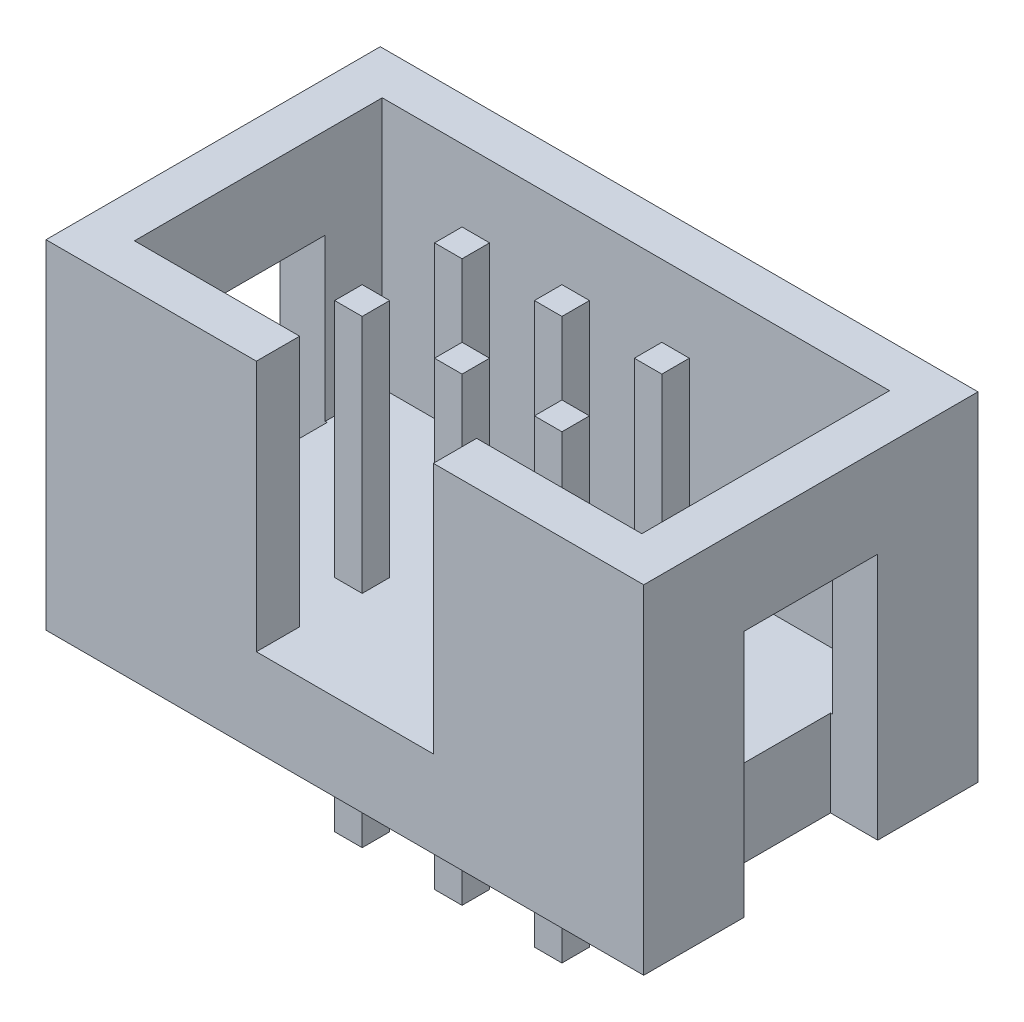
from build123d import *

# Parameters (mm, degrees)
SKETCH1_W            = 15.2
SKETCH1_H            = 8.5
BOSS_EXTRUDE1_DEPTH  = 8.6
SKETCH2_W            = 12.9
SKETCH2_H            = 6.3
CUT_EXTRUDE1_DEPTH   = 6.4
SKETCH3_W            = 4.5
SKETCH3_H            = 1.1
CUT_EXTRUDE2_DEPTH   = 6.4
SKETCH4_W            = 1.2
SKETCH4_H            = 3.4
CUT_EXTRUDE3_DEPTH   = 6.3
SKETCH6_W            = 0.9
SKETCH6_H            = 0.3
BOSS_EXTRUDE2_DEPTH  = 7.8
BOSS_EXTRUDE3_START  = -8.3
SKETCH7_W            = 0.7
SKETCH7_H            = 0.7
BOSS_EXTRUDE3_DEPTH  = 11.7
LPATTERN1_COUNT      = 3
LPATTERN1_PITCH      = 2.54
LPATTERN1_COUNT_DIR2 = 2
LPATTERN1_PITCH_DIR2 = 2.54


with BuildPart() as part:
    # Sketch1 → Boss-Extrude1 (new body)
    with BuildSketch(Plane(origin=(0, 0, 0), x_dir=(1, 0, 0), z_dir=(0, 1, 0))):
        Rectangle(SKETCH1_W, SKETCH1_H)
    extrude(amount=BOSS_EXTRUDE1_DEPTH)

    # Sketch2 → Cut-Extrude1 (cut)
    with BuildSketch(Plane(origin=(0, 8.6, 0), x_dir=(1, 0, 0), z_dir=(0, 1, 0))):
        Rectangle(SKETCH2_W, SKETCH2_H)
    extrude(amount=-CUT_EXTRUDE1_DEPTH, mode=Mode.SUBTRACT)

    # Sketch3 → Cut-Extrude2 (cut)
    with BuildSketch(Plane(origin=(0, 8.6, 0), x_dir=(1, 0, 0), z_dir=(0, 1, 0))):
        with Locations((0, -3.7)):
            Rectangle(SKETCH3_W, SKETCH3_H)
    extrude(amount=-CUT_EXTRUDE2_DEPTH, mode=Mode.SUBTRACT)

    # Sketch4 → Cut-Extrude3 (cut)
    with BuildSketch(Plane.XZ):
        with Locations((7, 0)):
            Rectangle(SKETCH4_W, SKETCH4_H)
    cut_extrude3 = extrude(amount=-CUT_EXTRUDE3_DEPTH, mode=Mode.SUBTRACT)

    # Sketch6 → Boss-Extrude2 (add)
    with BuildSketch(Plane.XZ):
        with Locations((4.95, -4.4)):
            Rectangle(SKETCH6_W, SKETCH6_H)
    boss_extrude2 = extrude(amount=-BOSS_EXTRUDE2_DEPTH)

    # Mirror1: Cut-Extrude3, Boss-Extrude2 across plane
    add(cut_extrude3.mirror(Plane(origin=(0, 0, 0), x_dir=(0, 0, 1), z_dir=(1, 0, 0))), mode=Mode.SUBTRACT)
    add(boss_extrude2.mirror(Plane(origin=(0, 0, 0), x_dir=(0, 0, 1), z_dir=(1, 0, 0))))

    # Sketch7 → Boss-Extrude3 (add)
    with BuildSketch(Plane.XZ.offset(BOSS_EXTRUDE3_START)):
        with Locations((-2.54, -1.27)):
            Rectangle(SKETCH7_W, SKETCH7_H)
    boss_extrude3 = extrude(amount=BOSS_EXTRUDE3_DEPTH)

    # LPattern1: Boss-Extrude3 3 × 2
    with Locations(*[(i * LPATTERN1_PITCH, 0, j * LPATTERN1_PITCH_DIR2) for i in range(LPATTERN1_COUNT) for j in range(LPATTERN1_COUNT_DIR2) if (i, j) != (0, 0)]):
        add(boss_extrude3)


solid = part.part
